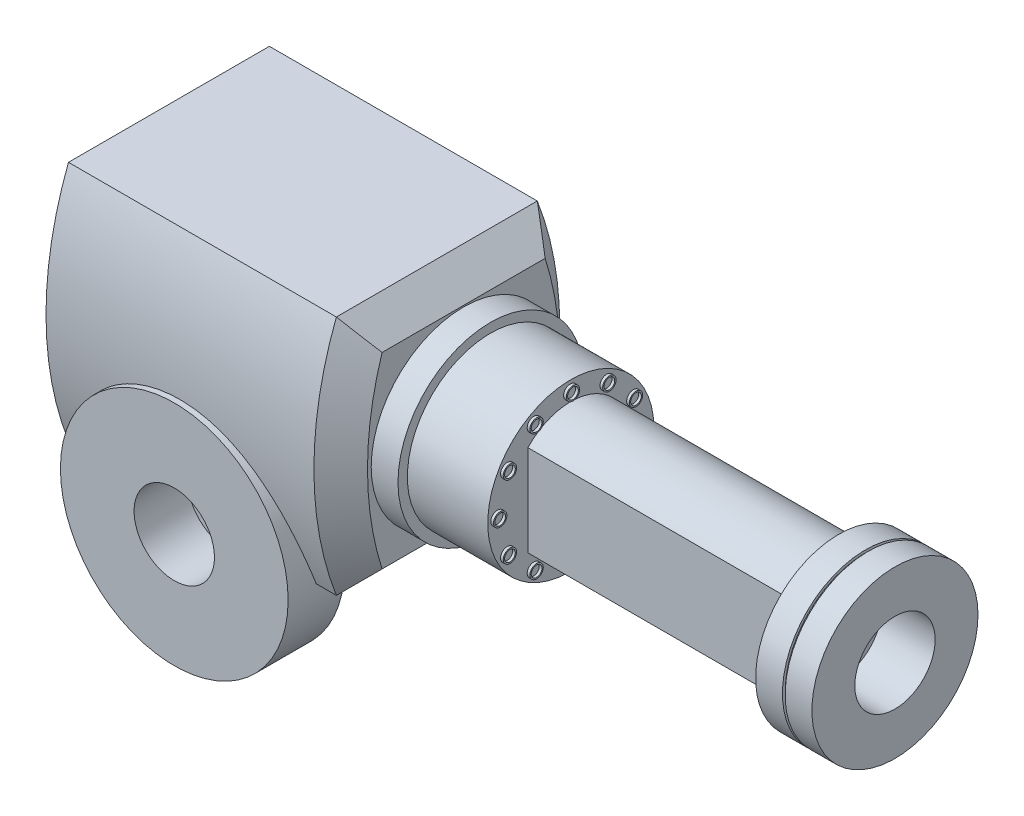
from build123d import *

# Parameters (mm, degrees)
BOSS_EXTRUDE1_DEPTH  = 100
BOSS_EXTRUDE2_DEPTH  = 10
BOSS_EXTRUDE2_DRAFT  = 45
SKETCH3_R            = 34.5
BOSS_EXTRUDE3_DEPTH  = 10
SKETCH4_R            = 31
BOSS_EXTRUDE4_DEPTH  = 30
SKETCH5_R            = 2.5
SKETCH5_R_2          = 2
BOSS_EXTRUDE5_DEPTH  = 1
CIRPATTERN1_COUNT    = 12
BOSS_EXTRUDE6_DEPTH  = 100
SKETCH7_R            = 31
BOSS_EXTRUDE7_DEPTH  = 10
SKETCH8_R            = 30
BOSS_EXTRUDE8_DEPTH  = 1
SKETCH9_R            = 31
BOSS_EXTRUDE9_DEPTH  = 10
SKETCH10_R           = 42.5
BOSS_EXTRUDE10_DEPTH = 10.5
BOSS_EXTRUDE11_DEPTH = 35
BOSS_EXTRUDE12_DEPTH = 40
CUT_EXTRUDE1_DEPTH   = 40
SKETCH14_R           = 15
CUT_EXTRUDE2_DEPTH   = 20
SKETCH15_R           = 15
CUT_EXTRUDE3_DEPTH   = 20


with BuildPart() as part:
    # Sketch1 → Boss-Extrude1 (new body)
    with BuildSketch(Plane(origin=(0, 0, 0), x_dir=(0, 0, -1), z_dir=(1, 0, 0))):
        with BuildLine():
            Line((-37.5, 45), (37.5, 45))
            ThreePointArc((37.5, 45), (45.880962103, 0), (37.5, -45))
            Line((37.5, -45), (-37.5, -45))
            ThreePointArc((-37.5, -45), (-45.880962103, 0), (-37.5, 45))
        make_face()
    extrude(amount=BOSS_EXTRUDE1_DEPTH)


with BuildPart() as boss_extrude2_tool:
    # Sketch2 → Boss-Extrude2 (with draft: the straight prism first)
    with BuildSketch(Plane(origin=(100, 0, 0), x_dir=(0, 0, -1), z_dir=(1, 0, 0))):
        with BuildLine():
            Line((37.5, 45), (-37.5, 45))
            ThreePointArc((-37.5, 45), (-45.880962103, 0), (-37.5, -45))
            Line((-37.5, -45), (37.5, -45))
            ThreePointArc((37.5, -45), (45.880962103, 0), (37.5, 45))
        make_face()
    extrude(amount=BOSS_EXTRUDE2_DEPTH)
    # Boss-Extrude2: the draft: its side faces are tilted about the plane it starts from
    boss_extrude2_sides = [boss_extrude2_tool.faces().sort_by_distance(p)[0] for p in [
        (105, -45, 0),
        (105, 0, -45.880962103),
        (105, 45, 0),
        (105, 0, 45.880962103),
    ]]
    draft(boss_extrude2_sides, Plane(origin=(100, 0, 0), x_dir=(0, 0, -1), z_dir=(1, 0, 0)), BOSS_EXTRUDE2_DRAFT)


with BuildPart() as part_1:
    add(part.part)

    # Boss-Extrude2: add boss_extrude2_tool
    add(boss_extrude2_tool.part)

    # Sketch3 → Boss-Extrude3 (add)
    with BuildSketch(Plane(origin=(110, 0, 0), x_dir=(0, 0, -1), z_dir=(1, 0, 0))):
        Circle(SKETCH3_R)
    extrude(amount=BOSS_EXTRUDE3_DEPTH)

    # Sketch4 → Boss-Extrude4 (add)
    with BuildSketch(Plane(origin=(120, 0, 0), x_dir=(0, 0, -1), z_dir=(1, 0, 0))):
        Circle(SKETCH4_R)
    extrude(amount=BOSS_EXTRUDE4_DEPTH)

    # Sketch5 → Boss-Extrude5 (add)
    with BuildSketch(Plane(origin=(150, 0, 0), x_dir=(0, 0, -1), z_dir=(1, 0, 0))):
        with Locations((27, 0)):
            Circle(SKETCH5_R)
        with Locations((27, 0)):
            Circle(SKETCH5_R_2, mode=Mode.SUBTRACT)
    boss_extrude5 = extrude(amount=BOSS_EXTRUDE5_DEPTH)

    # CirPattern1: Boss-Extrude5 ×12 about axis
    cirpattern1_axis = Axis((0, 0, 0.17674784), (1, 0, 0))
    for i in range(1, CIRPATTERN1_COUNT):
        add(boss_extrude5.rotate(cirpattern1_axis, i * 360 / CIRPATTERN1_COUNT))

    # Sketch6 → Boss-Extrude6 (add)
    with BuildSketch(Plane(origin=(150, 0, 0), x_dir=(0, 0, -1), z_dir=(1, 0, 0))):
        with BuildLine():
            Line((16, 0), (16, 17))
            ThreePointArc((16, 17), (0, 23.900331129), (-16, 17))
            Line((-16, 17), (-16, 0))
            Line((-16, 0), (-16, -17))
            ThreePointArc((-16, -17), (0, -23.900331129), (16, -17))
            Line((16, -17), (16, 0))
        make_face()
    extrude(amount=BOSS_EXTRUDE6_DEPTH)

    # Sketch7 → Boss-Extrude7 (add)
    with BuildSketch(Plane(origin=(250, 0, 0), x_dir=(0, 0, -1), z_dir=(1, 0, 0))):
        Circle(SKETCH7_R)
    extrude(amount=BOSS_EXTRUDE7_DEPTH)

    # Sketch8 → Boss-Extrude8 (add)
    with BuildSketch(Plane(origin=(260, 0, 0), x_dir=(0, 0, -1), z_dir=(1, 0, 0))):
        Circle(SKETCH8_R)
    extrude(amount=BOSS_EXTRUDE8_DEPTH)

    # Sketch9 → Boss-Extrude9 (add)
    with BuildSketch(Plane(origin=(261, 0, 0), x_dir=(0, 0, -1), z_dir=(1, 0, 0))):
        Circle(SKETCH9_R)
    extrude(amount=BOSS_EXTRUDE9_DEPTH)

    # Sketch10 → Boss-Extrude10 (add, symmetric)
    with BuildSketch(Plane.XY.offset(37.5)):
        with Locations((50, -45)):
            Circle(SKETCH10_R)
    extrude(amount=BOSS_EXTRUDE10_DEPTH, both=True)

    # Sketch11 → Boss-Extrude11 (add)
    with BuildSketch(Plane(origin=(0, 0, 27), x_dir=(-1, 0, 0), z_dir=(0, 0, -1))):
        with BuildLine():
            Line((-62.06556146, -45), (-22.06556146, -45))
            Line((-22.06556146, -45), (-22.06556146, -75))
            ThreePointArc((-22.06556146, -75), (-42.06556146, -82.639320225), (-62.06556146, -75))
            Line((-62.06556146, -75), (-62.06556146, -45))
        make_face()
    extrude(amount=BOSS_EXTRUDE11_DEPTH)

    # Sketch12 → Boss-Extrude12 (add)
    with BuildSketch(Plane(origin=(62.06556146, 0, 0), x_dir=(0, 0, -1), z_dir=(1, 0, 0))):
        with BuildLine():
            Line((8, -45), (33, -45))
            ThreePointArc((33, -45), (25.421855105, -68.929675658), (8, -87))
            Line((8, -87), (8, -45))
        make_face()
    extrude(amount=-BOSS_EXTRUDE12_DEPTH)

    # Sketch13 → Cut-Extrude1 (cut)
    with BuildSketch(Plane.XY.offset(-8)):
        with BuildLine():
            Line((22.06556146, -75), (22.06556146, -87))
            Line((22.06556146, -87), (62.06556146, -87))
            Line((62.06556146, -87), (62.06556146, -75))
            ThreePointArc((62.06556146, -75), (42.06556146, -82.639320225), (22.06556146, -75))
        make_face()
    extrude(amount=-CUT_EXTRUDE1_DEPTH, mode=Mode.SUBTRACT)

    # Sketch14 → Cut-Extrude2 (cut)
    with BuildSketch(Plane(origin=(271, 0, 0), x_dir=(0, 0, -1), z_dir=(1, 0, 0))):
        Circle(SKETCH14_R)
    extrude(amount=-CUT_EXTRUDE2_DEPTH, mode=Mode.SUBTRACT)

    # Sketch15 → Cut-Extrude3 (cut)
    with BuildSketch(Plane.XY.offset(48)):
        with Locations((50, -45)):
            Circle(SKETCH15_R)
    extrude(amount=-CUT_EXTRUDE3_DEPTH, mode=Mode.SUBTRACT)


solid = part_1.part
